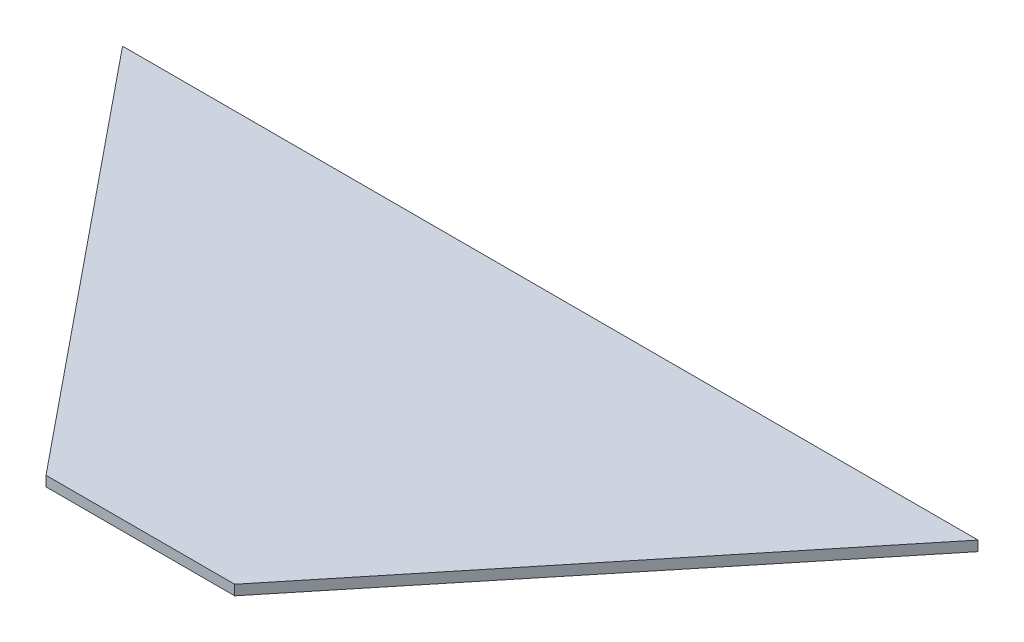
from build123d import *

# Parameters (mm, degrees)
EXTRUDE_1_DEPTH = 4


with BuildPart() as part:
    # Sketch 1 → Бобышка-Вытянуть1 (new body)
    with BuildSketch(Plane(origin=(-117.415970164, 10, 222.329336945), x_dir=(1, 0, 0), z_dir=(0, -1, 0))):
        Polygon((0, 0), (340, 0), (207.5, 162.922527601), (132.5, 162.922527601), align=None)
    extrude(amount=-EXTRUDE_1_DEPTH)


solid = part.part
